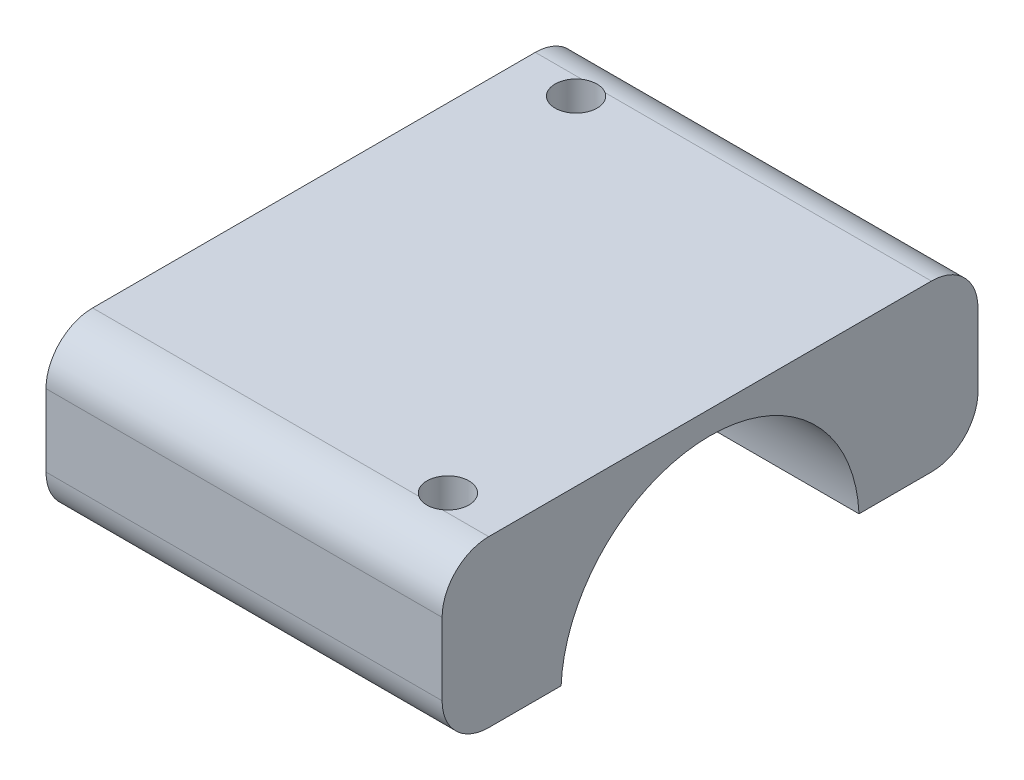
from build123d import *

# Parameters (mm, degrees)
BOSS_EXTRUDE1_DEPTH     = 17
CUT_EXTRUDE1_DEPTH      = 33.20310544
CUT_EXTRUDE1_DEPTH_BACK = 33.20310544
SKETCH2_R               = 12.8
SKETCH3_R               = 1.8
CUT_EXTRUDE2_DEPTH      = 14.8


with BuildPart() as part:
    # Sketch1 → Boss-Extrude1 (new, symmetric)
    with BuildSketch(Plane(origin=(0, 0, 0), x_dir=(0, 0, -1), z_dir=(1, 0, 0))):
        with BuildLine():
            Line((-19, 0.6), (19, 0.6))
            ThreePointArc((19, 0.6), (21.828427125, 1.771572875), (23, 4.6))
            Line((23, 4.6), (23, 10.8))
            ThreePointArc((23, 10.8), (21.828427125, 13.628427125), (19, 14.8))
            Line((19, 14.8), (-19, 14.8))
            ThreePointArc((-19, 14.8), (-21.828427125, 13.628427125), (-23, 10.8))
            Line((-23, 10.8), (-23, 4.6))
            ThreePointArc((-23, 4.6), (-21.828427125, 1.771572875), (-19, 0.6))
        make_face()
    extrude(amount=BOSS_EXTRUDE1_DEPTH, both=True)

    # Sketch2 → Cut-Extrude1 (cut, two sides: drawn at the far end of the back side and taken through both)
    with BuildSketch(Plane(origin=(0, 0, 0), x_dir=(0, 0, -1), z_dir=(1, 0, 0)).offset(-CUT_EXTRUDE1_DEPTH_BACK)):
        Circle(SKETCH2_R)
    extrude(amount=CUT_EXTRUDE1_DEPTH + CUT_EXTRUDE1_DEPTH_BACK, mode=Mode.SUBTRACT)

    # Sketch3 → Cut-Extrude2 (cut)
    with BuildSketch(Plane(origin=(0, 0.6, 0), x_dir=(1, 0, 0), z_dir=(0, 1, 0))):
        with Locations(Location((12, -17.5, 0), (0, 0, 236.442690238))):
            Circle(SKETCH3_R)
        with Locations(Location((-12, 17.5, 0), (0, 0, 123.557309762))):
            Circle(SKETCH3_R)
    extrude(amount=CUT_EXTRUDE2_DEPTH, mode=Mode.SUBTRACT)


solid = part.part
